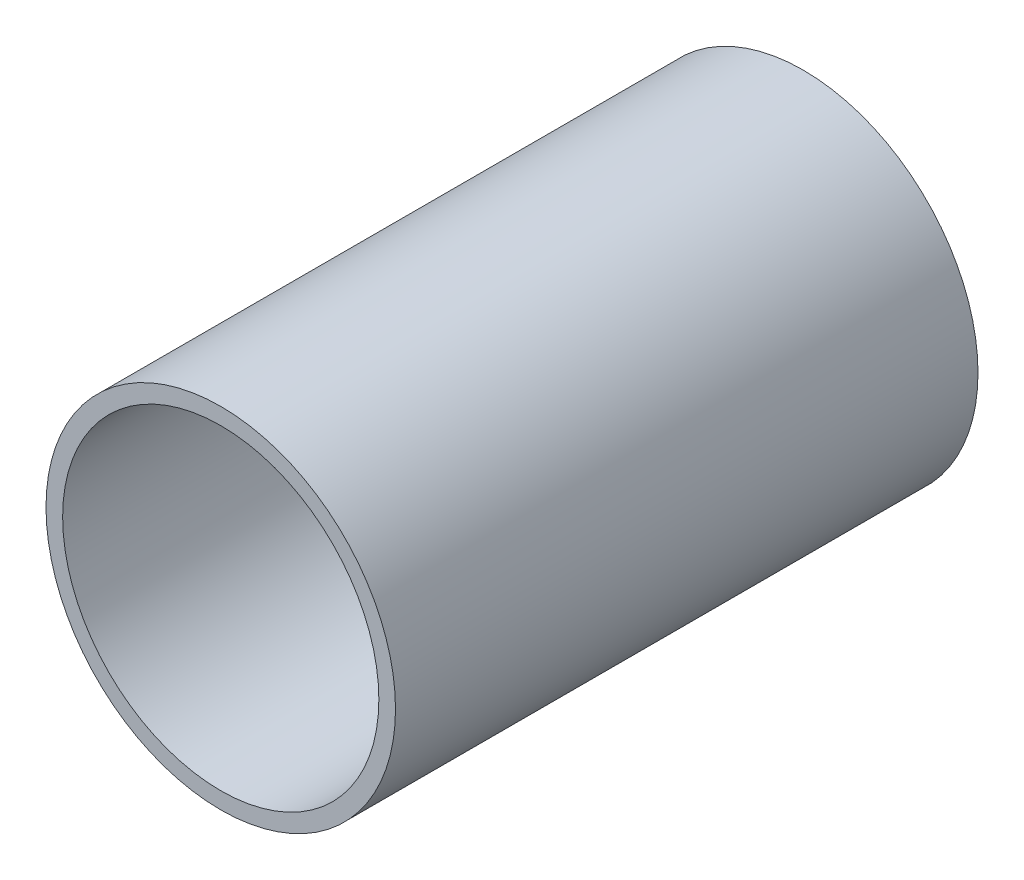
from build123d import *

# Parameters (mm, degrees)
SKETCH1_R           = 21
SKETCH1_R_2         = 19
BOSS_EXTRUDE1_DEPTH = 70


with BuildPart() as part:
    # Sketch1 → Boss-Extrude1 (new body)
    with BuildSketch(Plane.XY):
        Circle(SKETCH1_R)
        Circle(SKETCH1_R_2, mode=Mode.SUBTRACT)
    extrude(amount=BOSS_EXTRUDE1_DEPTH)


solid = part.part
